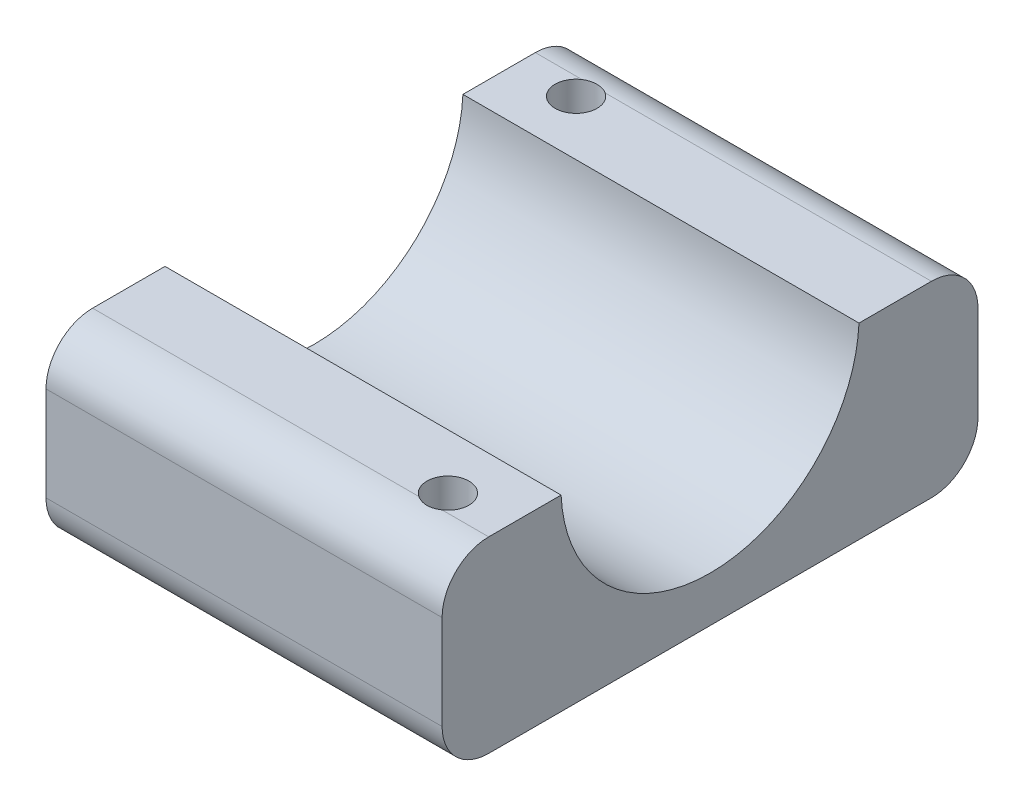
from build123d import *

# Parameters (mm, degrees)
BOSS_EXTRUDE1_DEPTH     = 17
CUT_EXTRUDE1_DEPTH      = 34.119329703
CUT_EXTRUDE1_DEPTH_BACK = 34.119329703
SKETCH2_R               = 12.8
SKETCH3_R               = 1.8
CUT_EXTRUDE2_DEPTH      = 17
SKETCH4_R               = 3.25
CUT_EXTRUDE3_DEPTH      = 4.3


with BuildPart() as part:
    # Sketch1 → Boss-Extrude1 (new, symmetric)
    with BuildSketch(Plane(origin=(0, 0, 0), x_dir=(0, 0, -1), z_dir=(1, 0, 0))):
        with BuildLine():
            Line((-19, -16.7), (19, -16.7))
            ThreePointArc((19, -16.7), (21.828427125, -15.528427125), (23, -12.7))
            Line((23, -12.7), (23, -4.6))
            ThreePointArc((23, -4.6), (21.828427125, -1.771572875), (19, -0.6))
            Line((19, -0.6), (-19, -0.6))
            ThreePointArc((-19, -0.6), (-21.828427125, -1.771572875), (-23, -4.6))
            Line((-23, -4.6), (-23, -12.7))
            ThreePointArc((-23, -12.7), (-21.828427125, -15.528427125), (-19, -16.7))
        make_face()
    extrude(amount=BOSS_EXTRUDE1_DEPTH, both=True)

    # Sketch2 → Cut-Extrude1 (cut, two sides: drawn at the far end of the back side and taken through both)
    with BuildSketch(Plane(origin=(0, 0, 0), x_dir=(0, 0, -1), z_dir=(1, 0, 0)).offset(-CUT_EXTRUDE1_DEPTH_BACK)):
        Circle(SKETCH2_R)
    extrude(amount=CUT_EXTRUDE1_DEPTH + CUT_EXTRUDE1_DEPTH_BACK, mode=Mode.SUBTRACT)

    # Sketch3 → Cut-Extrude2 (cut)
    with BuildSketch(Plane(origin=(0, -16.7, 0), x_dir=(1, 0, 0), z_dir=(0, 1, 0))):
        with Locations(Location((12, -17.5, 0), (0, 0, 236.442690238))):
            Circle(SKETCH3_R)
        with Locations(Location((-12, 17.5, 0), (0, 0, 56.442690238))):
            Circle(SKETCH3_R)
    extrude(amount=CUT_EXTRUDE2_DEPTH, mode=Mode.SUBTRACT)

    # Sketch4 → Cut-Extrude3 (cut)
    with BuildSketch(Plane(origin=(0, -16.7, 0), x_dir=(1, 0, 0), z_dir=(0, 1, 0))):
        with Locations(Location((12, -17.5, 0), (0, 0, 207.48642625))):
            Circle(SKETCH4_R)
        with Locations(Location((-12, 17.5, 0), (0, 0, 27.48642625))):
            Circle(SKETCH4_R)
    extrude(amount=CUT_EXTRUDE3_DEPTH, mode=Mode.SUBTRACT)


solid = part.part
